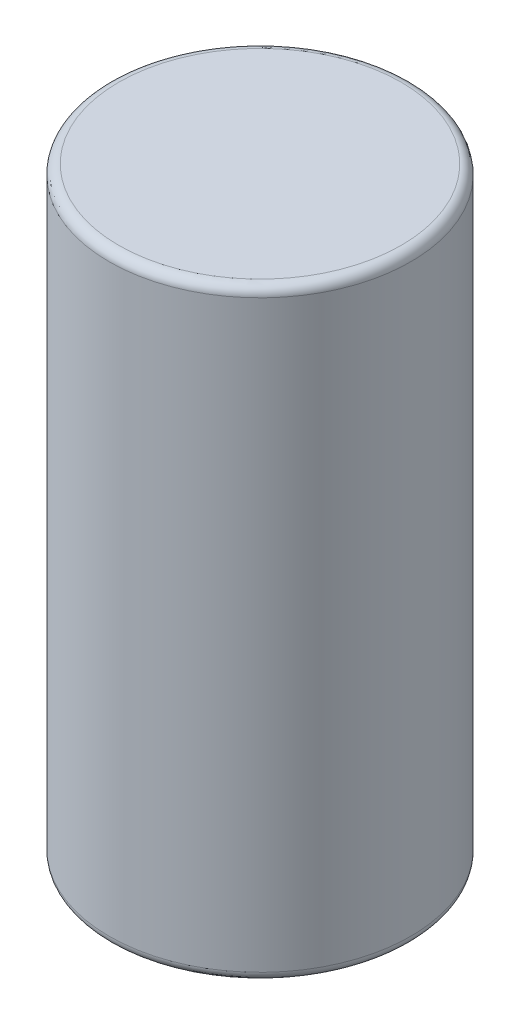
from build123d import *

# Parameters (mm, degrees)
SKETCH1_W = 3.175
SKETCH1_H = 12.7
FILLET1_R = 0.2


with BuildPart() as part:
    # Sketch1 → Revolve1 (revolve)
    with BuildSketch(Plane.XY, mode=Mode.PRIVATE) as revolve1_sk:
        with Locations((1.5875, 6.35)):
            Rectangle(SKETCH1_W, SKETCH1_H)
    revolve(revolve1_sk.sketch.rotate(Axis((0, 0, 0), (0, 1, 0)), 90), axis=Axis((0, 0, 0), (0, 1, 0)))

    # Fillet1
    fillet1_edges = [part.edges().sort_by_distance(p)[0] for p in [
        (0, 0, 3.175),
        (0, 12.7, 3.175),
    ]]
    fillet(fillet1_edges, radius=FILLET1_R)


solid = part.part
